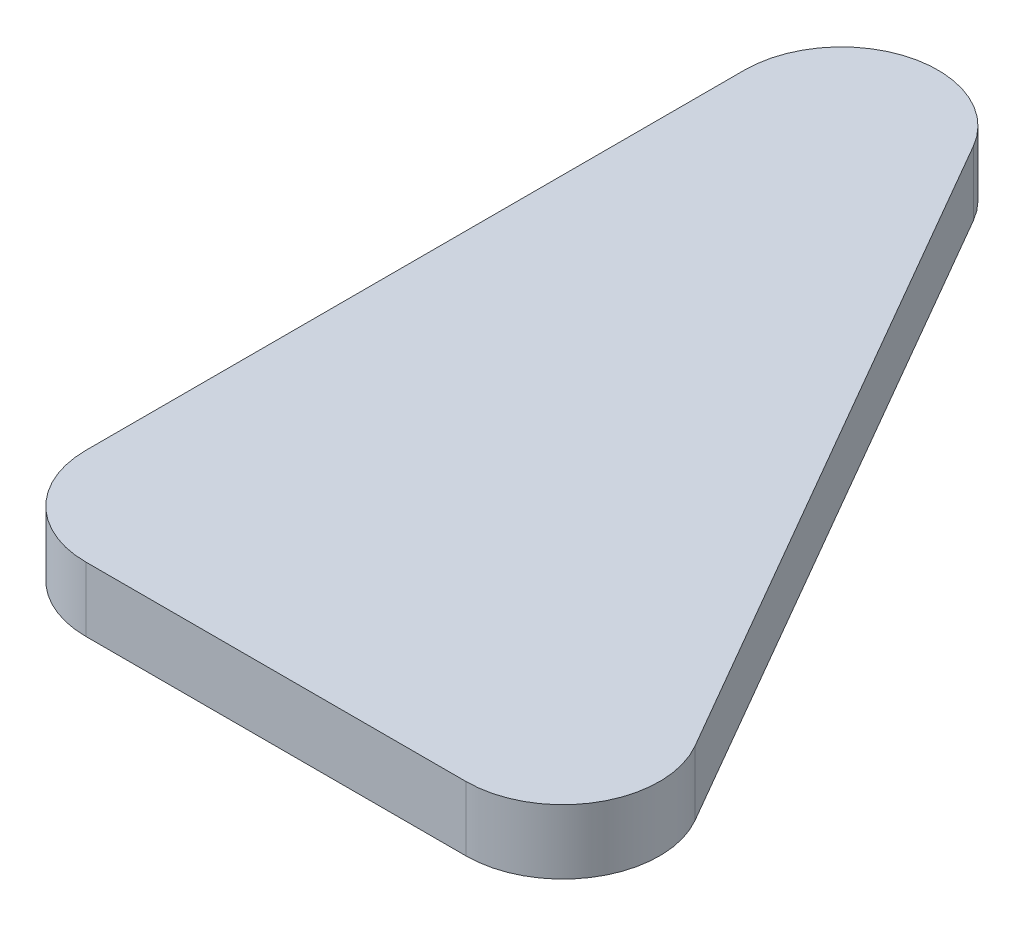
from build123d import *

# Parameters (mm, degrees)
BOSS_EXTRUDE1_DEPTH = 2
FILLET1_R           = 3


with BuildPart() as part:
    # Sketch1 → Boss-Extrude1 (new body)
    with BuildSketch(Plane(origin=(0, 0, 0), x_dir=(1, 0, 0), z_dir=(0, 1, 0))):
        Polygon((-10, 17.32), (-10, -17.32), (10, -17.32), align=None)
    extrude(amount=BOSS_EXTRUDE1_DEPTH)

    # Fillet1
    fillet1_edges = [part.edges().sort_by_distance(p)[0] for p in [
        (10, 1, 17.32),
        (-10, 1, 17.32),
        (-10, 1, -17.32),
    ]]
    fillet(fillet1_edges, radius=FILLET1_R)


solid = part.part
